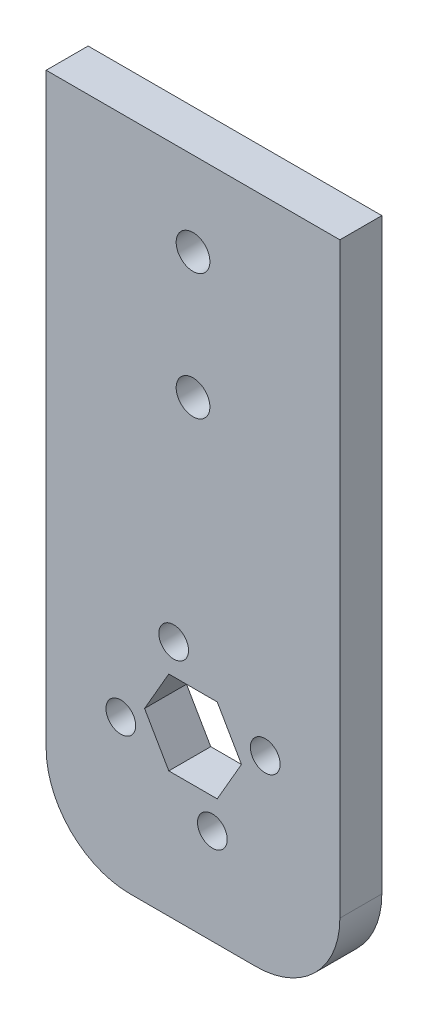
from build123d import *

# Parameters (mm, degrees)
SKETCH1_W                  = 44.45
SKETCH1_H                  = 101.6
BOSS_EXTRUDE2_DEPTH        = 6.35
FILLET1_R                  = 12.7
F_7_0_201_DIAMETER_HOLE2_D = 5.1054
CUT_EXTRUDE1_DEPTH         = 112.079633597
M4_CLEARANCE_HOLE1_D       = 4.5


with BuildPart() as part:
    # Sketch1 → Boss-Extrude2 (new body)
    with BuildSketch(Plane.XY):
        with Locations((-22.225, 50.8)):
            Rectangle(SKETCH1_W, SKETCH1_H)
    extrude(amount=BOSS_EXTRUDE2_DEPTH)

    # Fillet1
    fillet1_edges = [part.edges().sort_by_distance(p)[0] for p in [
        (0, 0, 3.175),
        (-44.45, 0, 3.175),
    ]]
    fillet(fillet1_edges, radius=FILLET1_R)

    # #7 (0.201) Diameter Hole2 (through all)
    with Locations(Plane(origin=(0, 0, 0), x_dir=(-1, 0, 0), z_dir=(0, 0, -1))):
        with Locations((22.225, 88.9), (22.225, 69.85)):
            Hole(F_7_0_201_DIAMETER_HOLE2_D / 2)

    # Sketch14 → Cut-Extrude1 (cut, through all)
    with BuildSketch(Plane.XY.offset(6.35)):
        Polygon((-14.892651581, 25.4), (-18.558825791, 31.75), (-25.891174209, 31.75), (-29.557348419, 25.4), (-25.891174209, 19.05), (-18.558825791, 19.05), align=None)
    extrude(amount=-CUT_EXTRUDE1_DEPTH, mode=Mode.SUBTRACT)

    # M4 Clearance Hole1 (through all)
    with Locations(Plane(origin=(0, 0, 0), x_dir=(-1, 0, 0), z_dir=(0, 0, -1))):
        with Locations((11.29679677, 28.32820323), (25.15320323, 36.32820323), (33.15320323, 22.47179677), (19.29679677, 14.47179677)):
            Hole(M4_CLEARANCE_HOLE1_D / 2)


solid = part.part
